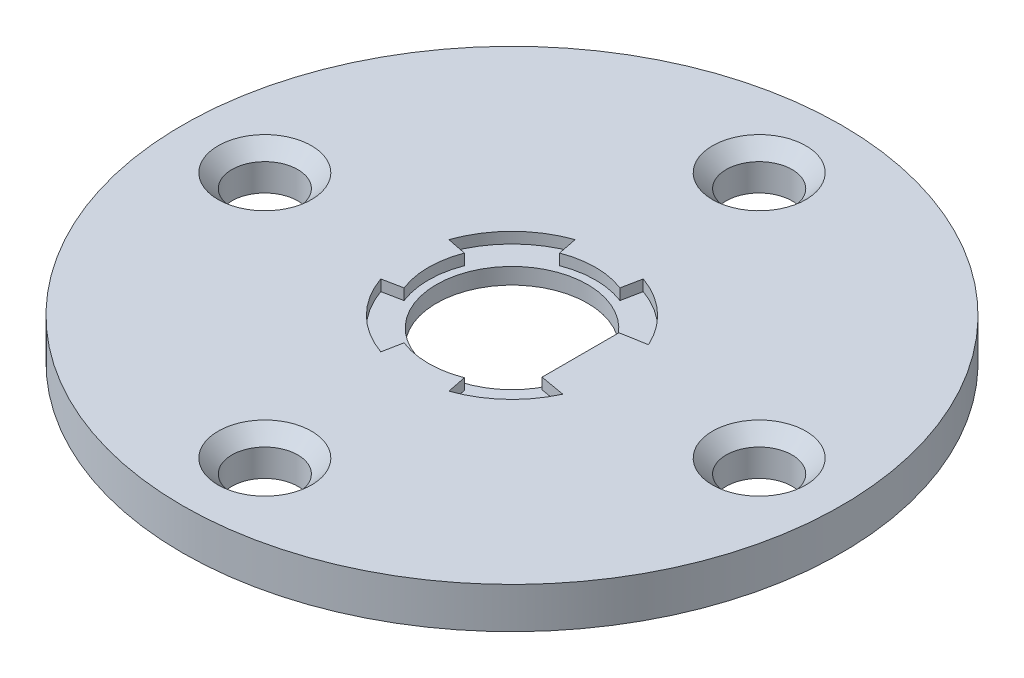
from build123d import *

# Parameters (mm, degrees)
SKETCH1_R           = 24
SKETCH1_R_2         = 2.4
BOSS_EXTRUDE1_DEPTH = 2.98
CUT_EXTRUDE1_DEPTH  = 0.8
SKETCH3_R           = 5.5
CUT_EXTRUDE2_DEPTH  = 35.011062906
CHAMFER1_SIZE       = 1
SKETCH4_R           = 12
CUT_EXTRUDE3_DEPTH  = 1


with BuildPart() as part:
    # Sketch1 → Boss-Extrude1 (new body)
    with BuildSketch(Plane(origin=(0, 0, 0), x_dir=(1, 0, 0), z_dir=(0, 1, 0))):
        with Locations(Location((0, 0, 0), (0, 0, 270))):
            Circle(SKETCH1_R)
        with Locations(Location((0, 18, 0), (0, 0, 270))):
            Circle(SKETCH1_R_2, mode=Mode.SUBTRACT)
        with Locations(Location((-18, 0, 0), (0, 0, 270))):
            Circle(SKETCH1_R_2, mode=Mode.SUBTRACT)
        with Locations(Location((0, -18, 0), (0, 0, 270))):
            Circle(SKETCH1_R_2, mode=Mode.SUBTRACT)
        with Locations(Location((18, 0, 0), (0, 0, 270))):
            Circle(SKETCH1_R_2, mode=Mode.SUBTRACT)
    extrude(amount=BOSS_EXTRUDE1_DEPTH)

    # Sketch2 → Cut-Extrude1 (cut)
    with BuildSketch(Plane(origin=(0, 2.98, 0), x_dir=(1, 0, 0), z_dir=(0, 1, 0))):
        with BuildLine():
            Line((4.989999, 2.798442301), (4.989999, -2.798442301))
            Line((4.989999, -2.798442301), (6.819742519, -3.121075451))
            ThreePointArc((6.819742519, -3.121075451), (5.052929001, -5.542373906), (2.479055714, -7.078437876))
            Line((2.479055714, -7.078437876), (2.198435941, -5.663259169))
            ThreePointArc((2.198435941, -5.663259169), (0, -6.075), (-2.198435941, -5.663259169))
            Line((-2.198435941, -5.663259169), (-2.479055714, -7.078437876))
            ThreePointArc((-2.479055714, -7.078437876), (-5.303300859, -5.303300859), (-7.078437876, -2.479055714))
            Line((-7.078437876, -2.479055714), (-5.663259169, -2.198435941))
            ThreePointArc((-5.663259169, -2.198435941), (-6.075, 0), (-5.663259169, 2.198435941))
            Line((-5.663259169, 2.198435941), (-7.078437876, 2.479055714))
            ThreePointArc((-7.078437876, 2.479055714), (-5.303300859, 5.303300859), (-2.479055714, 7.078437876))
            Line((-2.479055714, 7.078437876), (-2.198435941, 5.663259169))
            ThreePointArc((-2.198435941, 5.663259169), (0, 6.075), (2.198435941, 5.663259169))
            Line((2.198435941, 5.663259169), (2.479055714, 7.078437876))
            ThreePointArc((2.479055714, 7.078437876), (5.052929001, 5.542373906), (6.819742519, 3.121075451))
            Line((6.819742519, 3.121075451), (4.989999, 2.798442301))
        make_face()
    extrude(amount=-CUT_EXTRUDE1_DEPTH, mode=Mode.SUBTRACT)

    # Sketch3 → Cut-Extrude2 (cut, through all)
    with BuildSketch(Plane(origin=(0, 2.18, 0), x_dir=(1, 0, 0), z_dir=(0, 1, 0))):
        with Locations(Location((0, 0, 0), (0, 0, 270))):
            Circle(SKETCH3_R)
    extrude(amount=-CUT_EXTRUDE2_DEPTH, mode=Mode.SUBTRACT)

    # Chamfer1
    chamfer1_edges = [part.edges().sort_by_distance(p)[0] for p in [
        (0, 2.98, -20.4),
        (-18, 2.98, -2.4),
        (0, 2.98, 15.6),
        (18, 2.98, -2.4),
    ]]
    chamfer(chamfer1_edges, length=CHAMFER1_SIZE)

    # Sketch4 → Cut-Extrude3 (cut)
    with BuildSketch(Plane.XZ):
        with Locations(Location((0, 0, 0), (0, 0, 270))):
            Circle(SKETCH4_R)
    extrude(amount=-CUT_EXTRUDE3_DEPTH, mode=Mode.SUBTRACT)


solid = part.part
